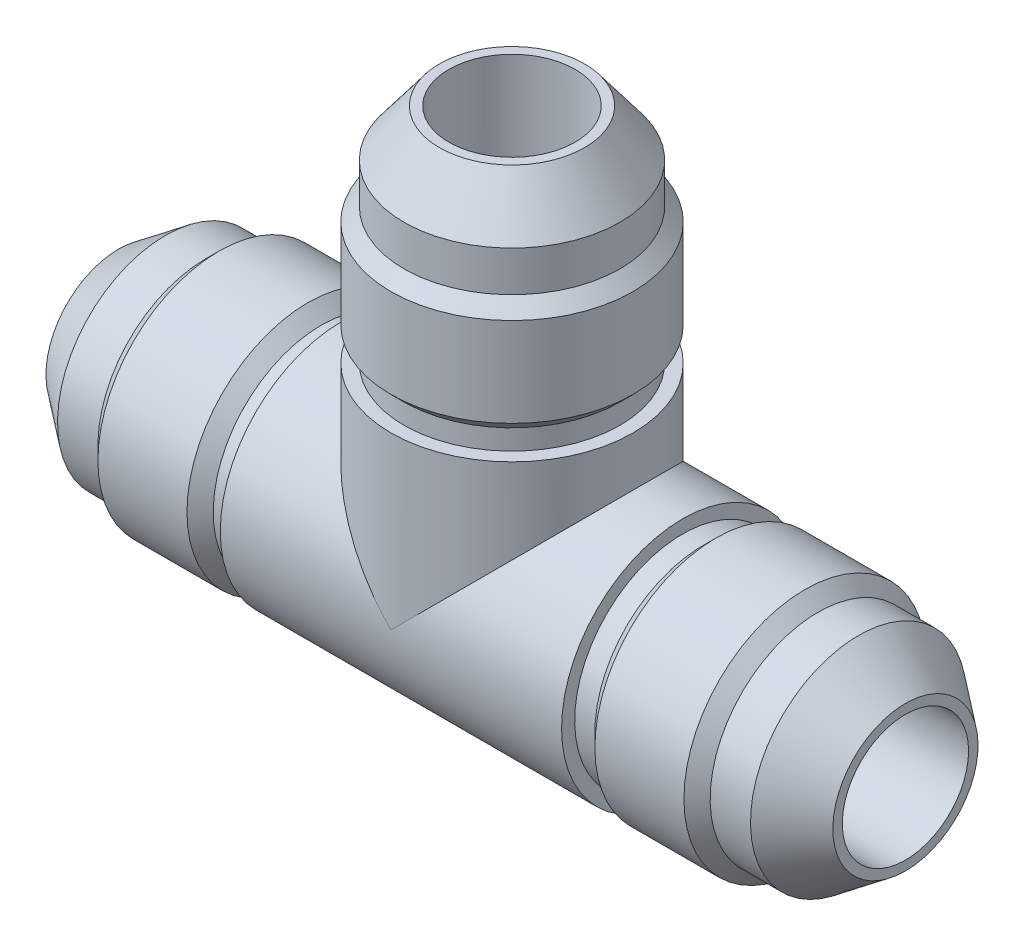
from build123d import *

# Parameters (mm, degrees)
SKETCH2_R           = 9.525
EXTRUDE1_DEPTH      = 17.526
SKETCH15_R          = 9.525
BOSS_EXTRUDE1_DEPTH = 13.4239
SKETCH16_R          = 4.9657
CUT_EXTRUDE1_DEPTH  = 34.754222847
CIRPATTERN1_COUNT   = 3
CIRPATTERN1_ANGLE   = 180
SKETCH17_R          = 4.9657
CUT_EXTRUDE2_DEPTH  = 70.858479622
CUT_EXTRUDE3_REACH  = 53.835
SKETCH18_R          = 4.9657


with BuildPart() as part:
    # Sketch2 → Extrude1 (new body)
    with BuildSketch(Plane(origin=(-30.9499, 0, 0), x_dir=(0, 0, -1), z_dir=(1, 0, 0))):
        Circle(SKETCH2_R)
    extrude(amount=EXTRUDE1_DEPTH)

    # Sketch5 → Cut-Revolve1 (revolve, cut)
    with BuildSketch(Plane.XY):
        Polygon((-27.256291687, 8.493888504), (-24.081291687, 8.493888504), (-23.050180191, 9.525), (-30.9499, 9.525), (-30.9499, 5.710555), align=None)
        Polygon((-13.4239, 8.493888504), (-15.0114, 8.493888504), (-16.042511496, 9.525), (-13.4239, 9.525), align=None)
    revolve(axis=Axis((0, 0, 0), (-1, 0, 0)), mode=Mode.SUBTRACT)

    # Sketch15 → Boss-Extrude1 (add)
    with BuildSketch(Plane(origin=(-13.4239, 0, 0), x_dir=(0, 0, -1), z_dir=(1, 0, 0))):
        with Locations(Location((0, 0, 0), (0, 0, 90))):
            Circle(SKETCH15_R)
    extrude(amount=BOSS_EXTRUDE1_DEPTH)

    # Sketch16 → Cut-Extrude1 (cut, through all)
    with BuildSketch(Plane(origin=(0, 0, 0), x_dir=(0, 0, -1), z_dir=(1, 0, 0))):
        Circle(SKETCH16_R)
    extrude(amount=-CUT_EXTRUDE1_DEPTH, mode=Mode.SUBTRACT)


with BuildPart() as cirpattern1_1:
    # CirPattern1: pattern copy
    add(part.part.rotate(Axis((0, 0, 0), (0, 0, -1)), 1 * CIRPATTERN1_ANGLE / (CIRPATTERN1_COUNT - 1)))

    # Sketch17 → Cut-Extrude2 (cut, through all)
    with BuildSketch(Plane.ZY.offset(30.9499)):
        with Locations(Location((0, 0, 0), (0, 0, 180))):
            Circle(SKETCH17_R)
    extrude(amount=-CUT_EXTRUDE2_DEPTH, mode=Mode.SUBTRACT)


with BuildPart() as cirpattern1_2:
    # CirPattern1: pattern copy
    add(part.part.rotate(Axis((0, 0, 0), (0, 0, -1)), 2 * CIRPATTERN1_ANGLE / (CIRPATTERN1_COUNT - 1)))


with BuildPart() as cirpattern1_1_1:
    add(cirpattern1_1.part)

    # Combine1: union part, CirPattern1_2
    add(part.part)
    add(cirpattern1_2.part)

    # Sketch18 → Cut-Extrude3 (cut, up to next)
    with BuildSketch(Plane(origin=(0, 30.9499, 0), x_dir=(1, 0, 0), z_dir=(0, 1, 0)), mode=Mode.PRIVATE) as cut_extrude3_sk1:
        with Locations(Location((0, 0, 0), (0, 0, 90))):
            Circle(SKETCH18_R)
    cut_extrude3_tool1 = extrude(cut_extrude3_sk1.sketch, amount=-CUT_EXTRUDE3_REACH, mode=Mode.PRIVATE) & cirpattern1_1_1.part
    add(cut_extrude3_tool1.solids().sort_by_distance((0, 30.9499, 0))[0], mode=Mode.SUBTRACT)


solid = cirpattern1_1_1.part
